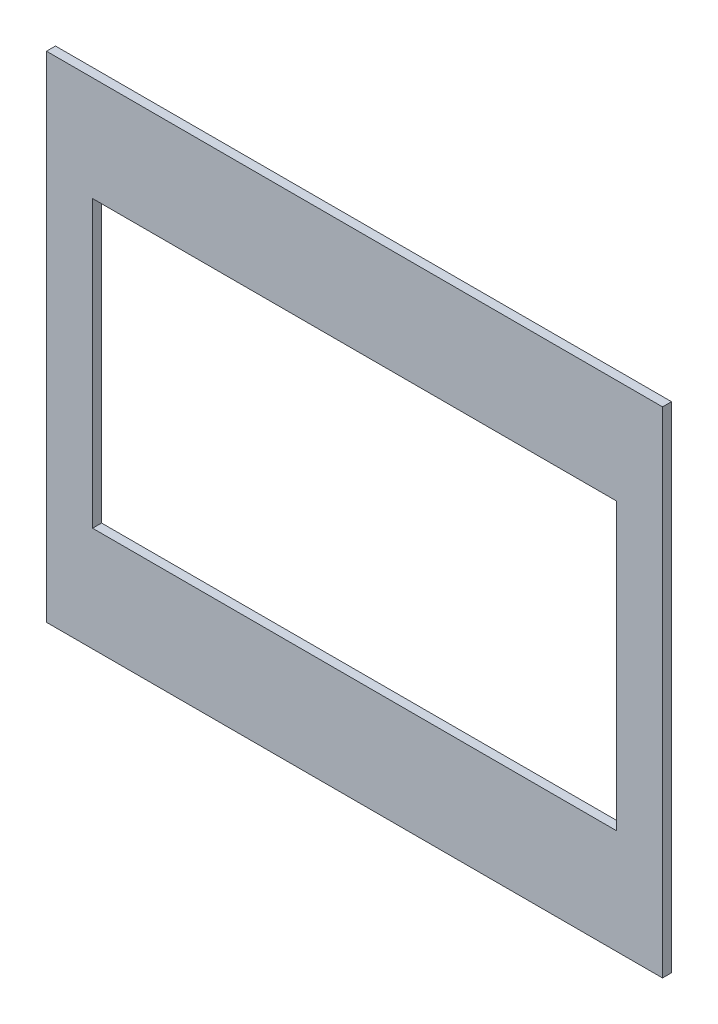
from build123d import *

# Parameters (mm, degrees)
SKETCH1_W           = 137
SKETCH1_H           = 110
SKETCH1_W_2         = 116.5
SKETCH1_H_2         = 63.5
BOSS_EXTRUDE1_DEPTH = 2


with BuildPart() as part:
    # Sketch1 → Boss-Extrude1 (new body)
    with BuildSketch(Plane.XY):
        Rectangle(SKETCH1_W, SKETCH1_H)
        Rectangle(SKETCH1_W_2, SKETCH1_H_2, mode=Mode.SUBTRACT)
    extrude(amount=BOSS_EXTRUDE1_DEPTH)


solid = part.part
